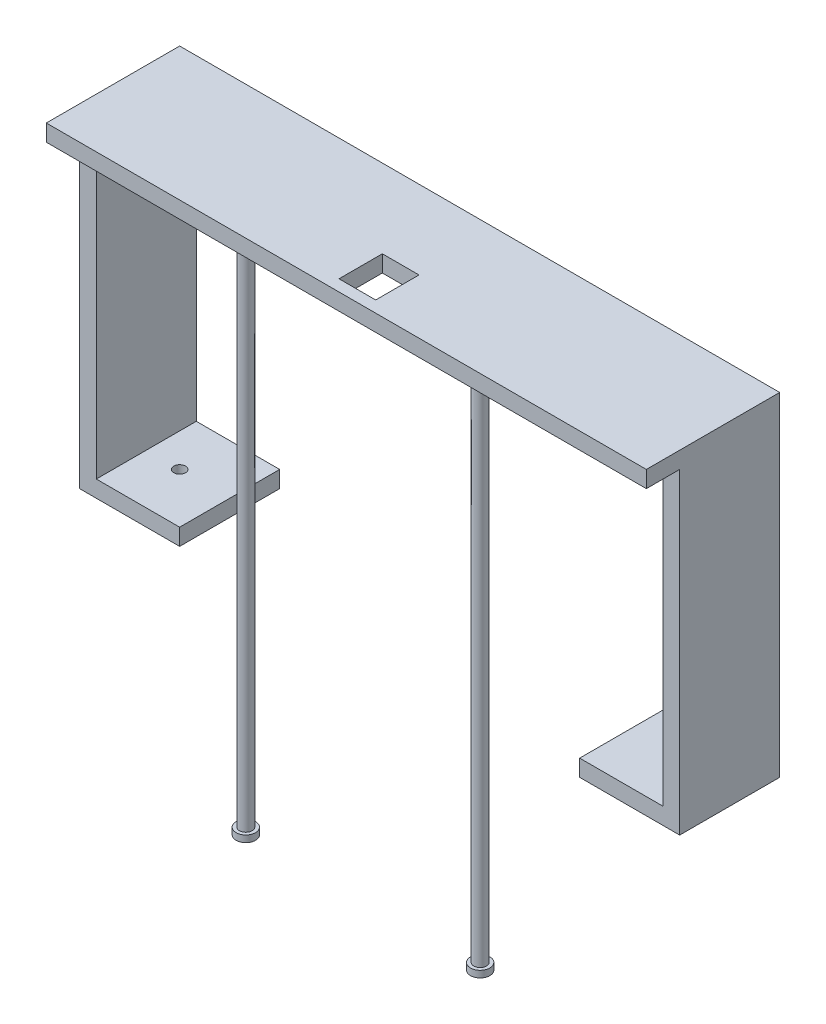
from build123d import *

# Parameters (mm, degrees)
BOSS_EXTRUDE1_DEPTH   = 30
SKETCH2_R             = 1.75
CUT_EXTRUDE1_DEPTH    = 10
SKETCH3_R             = 1.9
BOSS_EXTRUDE2_DEPTH   = 155
BOSS_EXTRUDE2_2_DEPTH = 155
BOSS_EXTRUDE3_DEPTH   = 10
BOSS_EXTRUDE4_START   = -2
SKETCH6_R             = 2.9
SKETCH6_R_2           = 1.9
BOSS_EXTRUDE4_DEPTH   = 2
SKETCH7_W             = 11
SKETCH7_H             = 13
CUT_EXTRUDE2_DEPTH    = 240.426397876


with BuildPart() as part:
    # Sketch1 → Boss-Extrude1 (new body)
    with BuildSketch(Plane.XY):
        Polygon((30, 0), (0, 0), (0, 100), (180, 100), (180, 0), (150, 0), (150, 5), (175, 5), (175, 95), (5, 95), (5, 5), (30, 5), align=None)
    extrude(amount=-BOSS_EXTRUDE1_DEPTH)

    # Sketch2 → Cut-Extrude1 (cut)
    with BuildSketch(Plane.XZ):
        with Locations((15, -15)):
            Circle(SKETCH2_R)
        with Locations(Location((165, -15, 0), (0, 0, 90))):
            Circle(SKETCH2_R)
    extrude(amount=-CUT_EXTRUDE1_DEPTH, mode=Mode.SUBTRACT)



with BuildPart() as body_2:
    # Sketch3 → Boss-Extrude2 (new body)
    with BuildSketch(Plane.XZ.offset(-95)):
        with Locations((54.85, 5)):
            Circle(SKETCH3_R)
    extrude(amount=BOSS_EXTRUDE2_DEPTH)


with BuildPart() as body_3:
    # Sketch3 → Boss-Extrude2 2 (new body)
    with BuildSketch(Plane.XZ.offset(-95)):
        with Locations(Location((125.15, 5, 0), (0, 0, 180))):
            Circle(SKETCH3_R)
    extrude(amount=BOSS_EXTRUDE2_2_DEPTH)


with BuildPart() as part_1:
    add(part.part)

    add(body_2.part)  # Boss-Extrude3 merges body 2

    add(body_3.part)  # Boss-Extrude3 merges body 3
    # Sketch5 → Boss-Extrude3 (add)
    with BuildSketch(Plane.XY):
        Polygon((0, 95), (5, 95), (175, 95), (180, 95), (180, 100), (0, 100), align=None)
    extrude(amount=BOSS_EXTRUDE3_DEPTH)

    # Sketch6 → Boss-Extrude4 (add)
    # profile 1 of 2: a face of its own
    with BuildSketch(Plane.XZ.offset(60).offset(BOSS_EXTRUDE4_START)):
        with Locations((54.85, 5)):
            Circle(SKETCH6_R)
        with Locations((54.85, 5)):
            Circle(SKETCH6_R_2, mode=Mode.SUBTRACT)
    # profile 2 of 2: a face of its own
    with BuildSketch(Plane.XZ.offset(60).offset(BOSS_EXTRUDE4_START)):
        with Locations((125.15, 5)):
            Circle(SKETCH6_R)
        with Locations(Location((125.15, 5, 0), (0, 0, 180))):
            Circle(SKETCH6_R_2, mode=Mode.SUBTRACT)
    extrude(amount=BOSS_EXTRUDE4_DEPTH)

    # Sketch7 → Cut-Extrude2 (cut, through all)
    with BuildSketch(Plane.XZ.offset(-95)):
        with Locations((89.880118622, 0.075917746)):
            Rectangle(SKETCH7_W, SKETCH7_H)
    extrude(amount=-CUT_EXTRUDE2_DEPTH, mode=Mode.SUBTRACT)


solid = part_1.part
